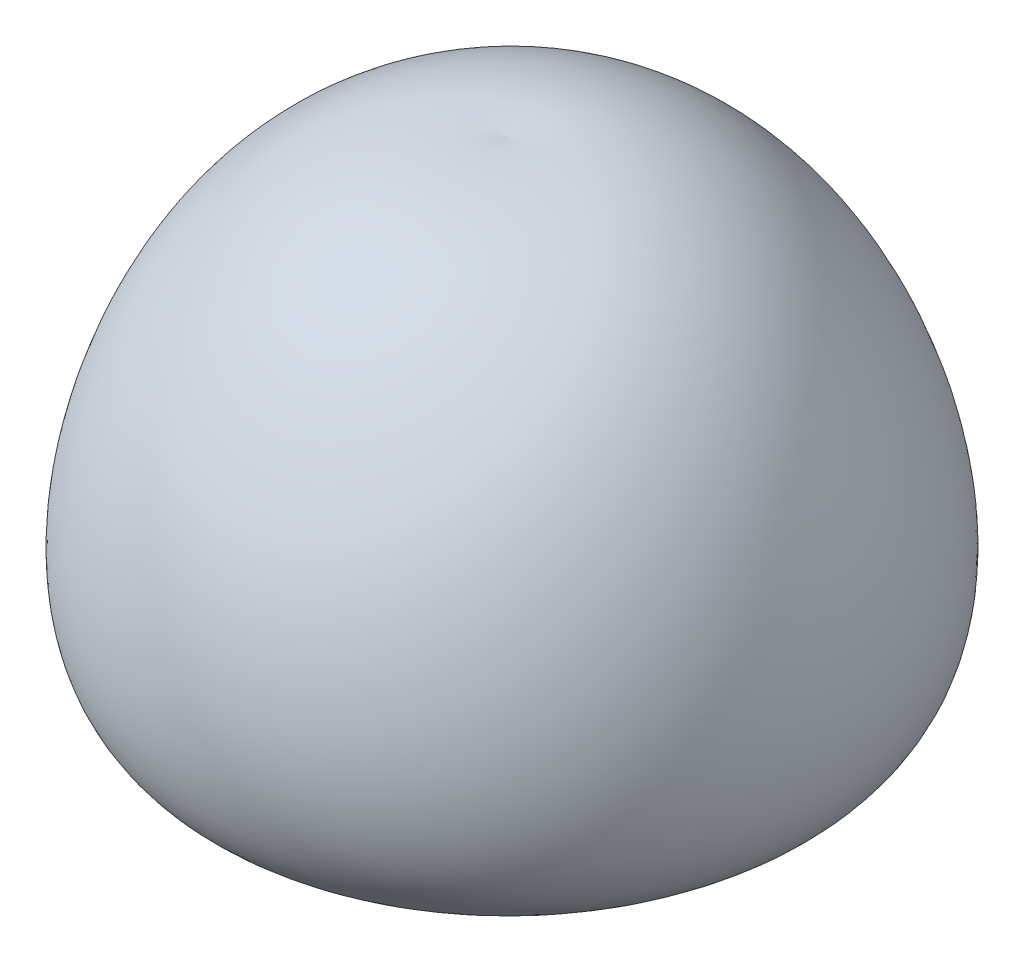
from build123d import *


with BuildPart() as part:
    # 草图1 → 旋转1 (revolve)
    with BuildSketch(Plane.XY):
        with BuildLine():
            Line((2.316319377, 8.077364618), (2.473544958, -1.922635382))
            add(Edge.make_bspline(
                [(2.316319377, 8.077364618), (-0.845658429, 8.430613833), (-6.708222968, 3.235534762), (-5.435976208, -6.468478636), (2.473544958, -1.922635382)],
                knots=[0, 0, 0, 0, 0.408524992, 1, 1, 1, 1], degree=3))
        make_face()
    revolve(axis=Axis((2.316319377, 8.077364618, 0), (0.01572061517446641, -0.9998764234936918, 0)))


solid = part.part
